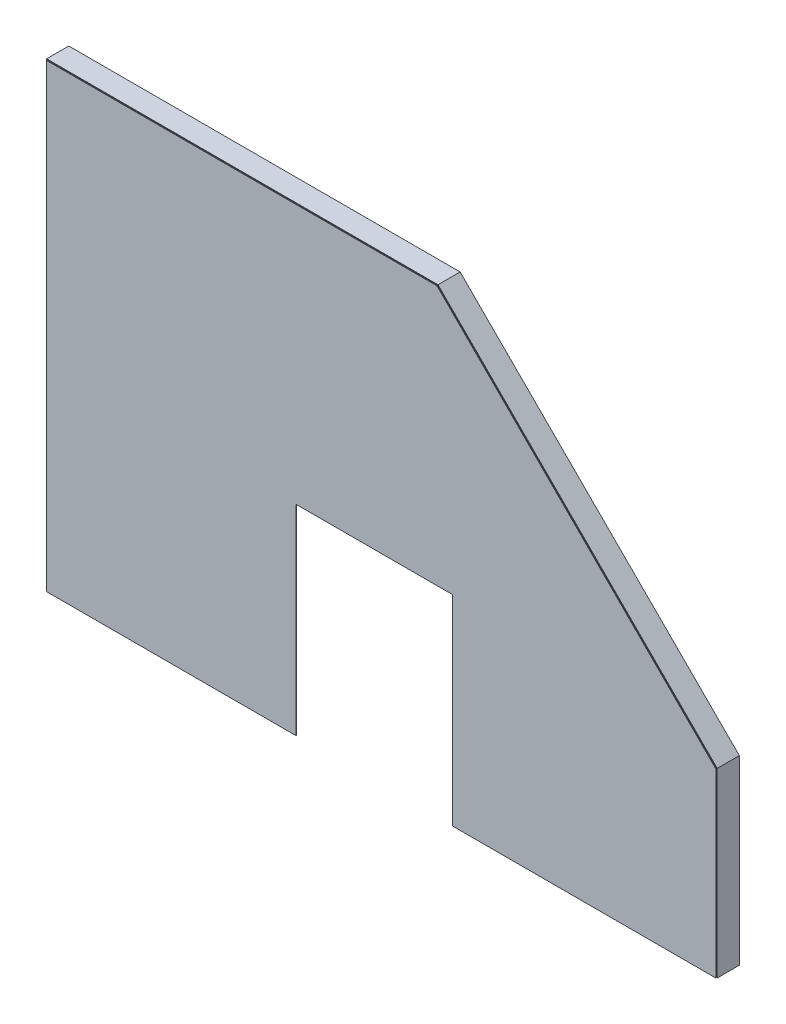
from build123d import *

# Parameters (mm, degrees)
SALIENTE_EXTRUIR1_DEPTH = 0.83566
SALIENTE_EXTRUIR2_DEPTH = 25.4
CORTAR_EXTRUIR1_DEPTH   = 90


with BuildPart() as part:
    # Croquis1 → Saliente-Extruir1 (new body)
    with BuildSketch(Plane.XY):
        Polygon((0, 0), (768, 0), (768, 208), (448, 528), (0, 528), align=None)
    extrude(amount=SALIENTE_EXTRUIR1_DEPTH)

    # Croquis4 → Cortar-Extruir1 (cut)
    with BuildSketch(Plane.XY.offset(0.83566)):
        Polygon((286, 90), (286, 230), (466, 230), (466, 90), (466, 0), (286, 0), align=None)
    extrude(amount=-CORTAR_EXTRUIR1_DEPTH, mode=Mode.SUBTRACT)


with BuildPart() as body_2:
    # Croquis3 → Saliente-Extruir2 (new body)
    with BuildSketch(Plane(origin=(0, 0, 0), x_dir=(-1, 0, 0), z_dir=(0, 0, -1))):
        Polygon((0.83566, 0), (0.83566, 528.83566), (-448.346141706, 528.83566), (-768.83566, 208.346141706), (-768.83566, 0), (-768, 0), (-768, 208), (-448, 528), (0, 528), (0, 0), align=None)
    extrude(amount=SALIENTE_EXTRUIR2_DEPTH)


solid = Compound([part.part, body_2.part])
